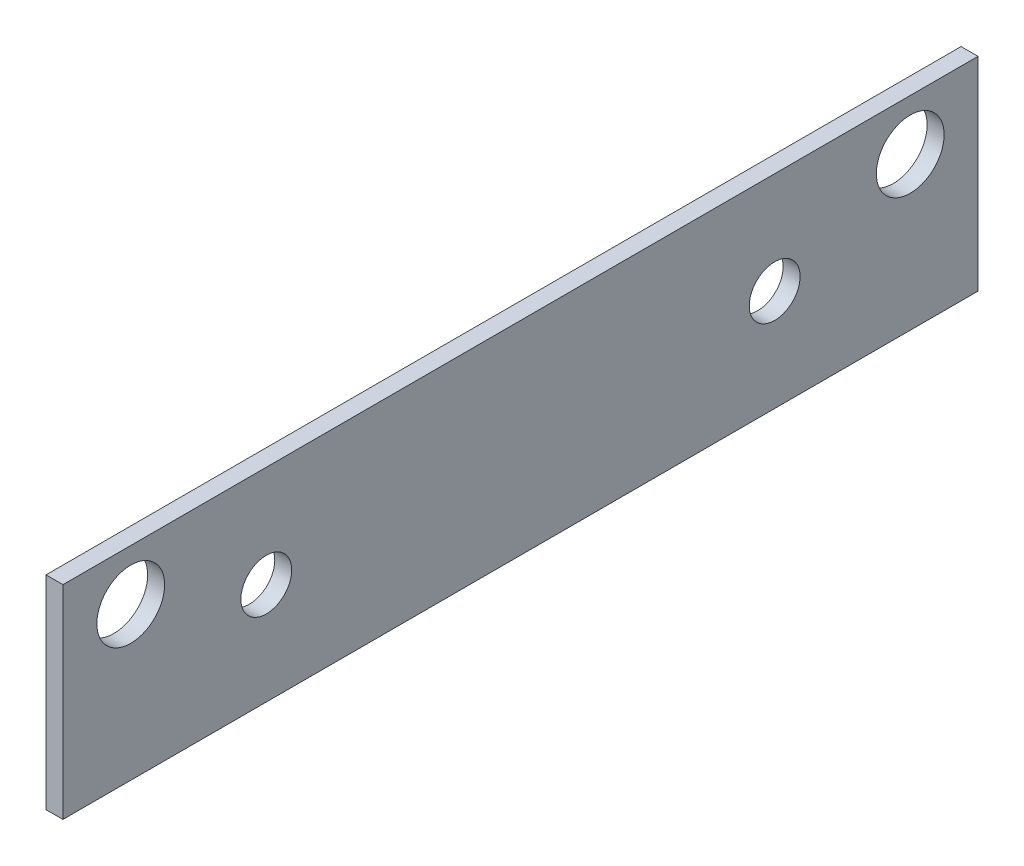
from build123d import *

# Parameters (mm, degrees)
SKETCH1_W           = 5
SKETCH1_H           = 60
BOSS_EXTRUDE1_DEPTH = 270
CUT_EXTRUDE1_REACH  = 273.708
SKETCH2_R           = 7.5
SKETCH2_R_2         = 10


with BuildPart() as part:
    # Sketch1 → Boss-Extrude1 (new body)
    with BuildSketch(Plane.XY):
        Rectangle(SKETCH1_W, SKETCH1_H)
    extrude(amount=BOSS_EXTRUDE1_DEPTH)

    # Sketch2 → Cut-Extrude1 (cut, up to next)
    with BuildSketch(Plane(origin=(2.5, 0, 0), x_dir=(0, 0, -1), z_dir=(1, 0, 0)), mode=Mode.PRIVATE) as cut_extrude1_sk1:
        with Locations((-60, 0)):
            Circle(SKETCH2_R)
    cut_extrude1_tool1 = extrude(cut_extrude1_sk1.sketch, amount=-CUT_EXTRUDE1_REACH, mode=Mode.PRIVATE) & part.part
    # Sketch2 → Cut-Extrude1 (cut, up to next)
    with BuildSketch(Plane(origin=(2.5, 0, 0), x_dir=(0, 0, -1), z_dir=(1, 0, 0)), mode=Mode.PRIVATE) as cut_extrude1_sk2:
        with Locations((-210, 0)):
            Circle(SKETCH2_R)
    cut_extrude1_tool2 = extrude(cut_extrude1_sk2.sketch, amount=-CUT_EXTRUDE1_REACH, mode=Mode.PRIVATE) & part.part
    # Sketch2 → Cut-Extrude1 (cut, up to next)
    with BuildSketch(Plane(origin=(2.5, 0, 0), x_dir=(0, 0, -1), z_dir=(1, 0, 0)), mode=Mode.PRIVATE) as cut_extrude1_sk3:
        with Locations((-250, 15)):
            Circle(SKETCH2_R_2)
    cut_extrude1_tool3 = extrude(cut_extrude1_sk3.sketch, amount=-CUT_EXTRUDE1_REACH, mode=Mode.PRIVATE) & part.part
    # Sketch2 → Cut-Extrude1 (cut, up to next)
    with BuildSketch(Plane(origin=(2.5, 0, 0), x_dir=(0, 0, -1), z_dir=(1, 0, 0)), mode=Mode.PRIVATE) as cut_extrude1_sk4:
        with Locations((-20, 15)):
            Circle(SKETCH2_R_2)
    cut_extrude1_tool4 = extrude(cut_extrude1_sk4.sketch, amount=-CUT_EXTRUDE1_REACH, mode=Mode.PRIVATE) & part.part
    add(cut_extrude1_tool1.solids().sort_by_distance((2.5, 0, 60))[0], mode=Mode.SUBTRACT)
    add(cut_extrude1_tool2.solids().sort_by_distance((2.5, 0, 210))[0], mode=Mode.SUBTRACT)
    add(cut_extrude1_tool3.solids().sort_by_distance((2.5, 15, 250))[0], mode=Mode.SUBTRACT)
    add(cut_extrude1_tool4.solids().sort_by_distance((2.5, 15, 20))[0], mode=Mode.SUBTRACT)


solid = part.part
